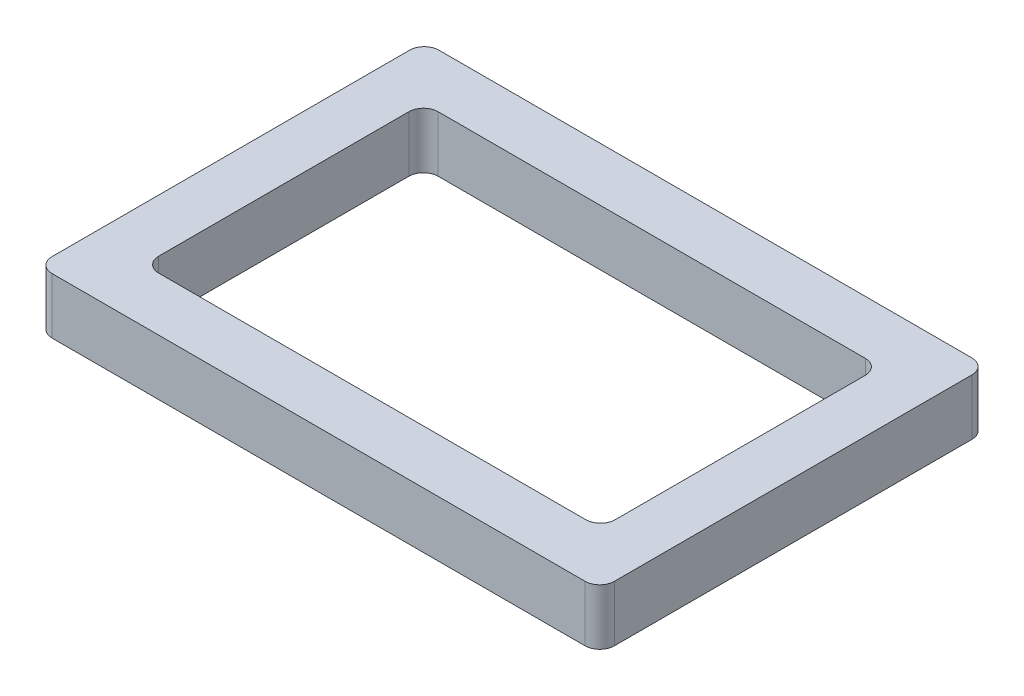
from build123d import *

# Parameters (mm, degrees)
BOSS_EXTRUDE1_DEPTH = 38.1


with BuildPart() as part:
    # Sketch1 → Boss-Extrude1 (new body)
    with BuildSketch(Plane(origin=(0, 0, 0), x_dir=(1, 0, 0), z_dir=(0, 1, 0))):
        with BuildLine():
            Line((-181.65, -131.85), (181.65, -131.85))
            ThreePointArc((181.65, -131.85), (188.721067812, -128.921067812), (191.65, -121.85))
            Line((191.65, -121.85), (191.65, 121.85))
            ThreePointArc((191.65, 121.85), (188.721067812, 128.921067812), (181.65, 131.85))
            Line((181.65, 131.85), (-181.65, 131.85))
            ThreePointArc((-181.65, 131.85), (-188.721067812, 128.921067812), (-191.65, 121.85))
            Line((-191.65, 121.85), (-191.65, -121.85))
            ThreePointArc((-191.65, -121.85), (-188.721067812, -128.921067812), (-181.65, -131.85))
        make_face()
        with BuildLine():
            Line((-145.575, -95.25), (145.575, -95.25))
            ThreePointArc((145.575, -95.25), (152.646067812, -92.321067812), (155.575, -85.25))
            Line((155.575, -85.25), (155.575, 85.25))
            ThreePointArc((155.575, 85.25), (152.646067812, 92.321067812), (145.575, 95.25))
            Line((145.575, 95.25), (-145.575, 95.25))
            ThreePointArc((-145.575, 95.25), (-152.646067812, 92.321067812), (-155.575, 85.25))
            Line((-155.575, 85.25), (-155.575, -85.25))
            ThreePointArc((-155.575, -85.25), (-152.646067812, -92.321067812), (-145.575, -95.25))
        make_face(mode=Mode.SUBTRACT)
    extrude(amount=BOSS_EXTRUDE1_DEPTH)


solid = part.part
